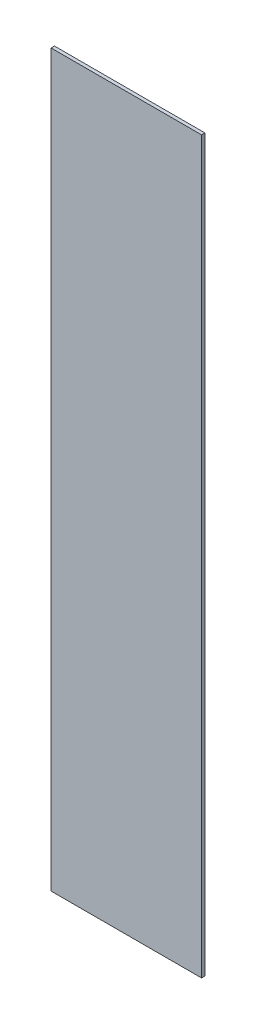
from build123d import *

# Parameters (mm, degrees)
ESBO_O1_W                = 67
ESBO_O1_H                = 325
RESSALTO_EXTRUS_O1_DEPTH = 1.5


with BuildPart() as part:
    # Esboço1 → Ressalto-extrusão1 (new body)
    with BuildSketch(Plane.XY):
        Rectangle(ESBO_O1_W, ESBO_O1_H)
    extrude(amount=RESSALTO_EXTRUS_O1_DEPTH)


solid = part.part
